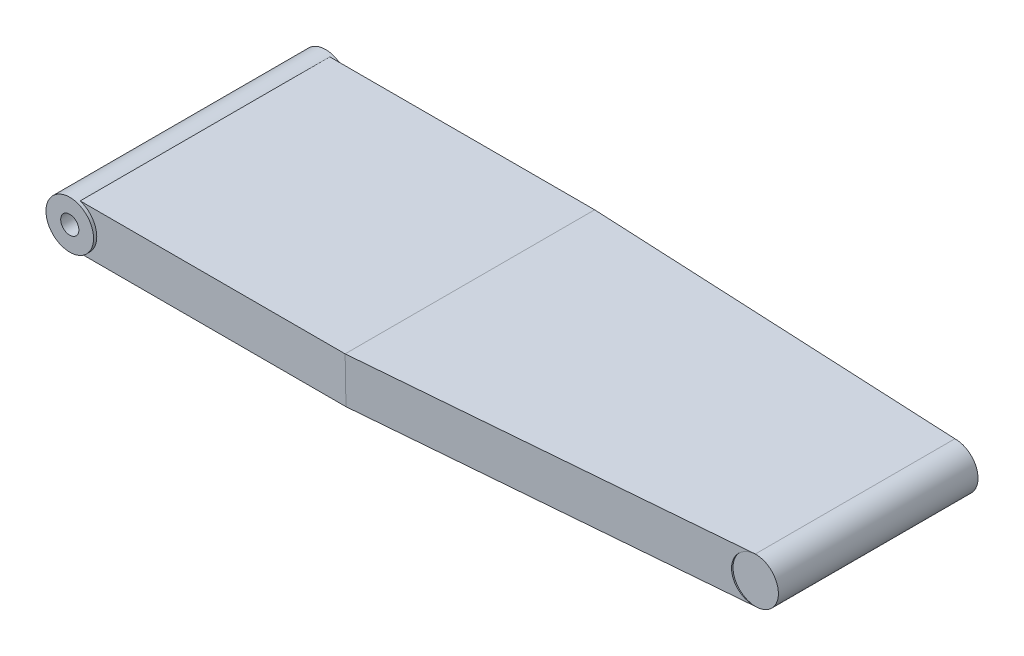
from build123d import *

# Parameters (mm, degrees)
RESSALTO_EXTRUS_O1_DEPTH = 28.2
RESSALTO_EXTRUS_O3_DEPTH = 22
RESSALTO_EXTRUS_O4_DEPTH = 27.5
RESSALTO_EXTRUS_O5_DEPTH = 27.5
CORTE_EXTRUS_O3_DEPTH    = 153.972464187
ESBO_O3_R                = 2
CORTE_EXTRUS_O4_DEPTH    = 161.384600668


with BuildPart() as part:
    # Esboço1 → Ressalto-extrusão1 (new, symmetric)
    with BuildSketch(Plane.XY):
        with BuildLine():
            ThreePointArc((5.25, 0), (4.239918087, 3.096061146), (1.598344907, 5.000779295))
            ThreePointArc((1.598344907, 5.000779295), (-5.25, 0), (1.598344907, -5.000779295))
            ThreePointArc((1.598344907, -5.000779295), (4.239918087, -3.096061146), (5.25, 0))
        make_face()
    extrude(amount=RESSALTO_EXTRUS_O1_DEPTH, both=True)

    # Esboço1<7> → Ressalto-extrusão4 (add, symmetric)
    with BuildSketch(Plane.XY):
        with BuildLine():
            Line((60, 5.000779295), (1.598344907, 5.000779295))
            ThreePointArc((1.598344907, 5.000779295), (4.239918087, 3.096061146), (5.25, 0))
            ThreePointArc((5.25, 0), (4.239918087, -3.096061146), (1.598344907, -5.000779295))
            Line((1.598344907, -5.000779295), (60, -5.000779295))
            Line((60, -5.000779295), (60, 5.000779295))
        make_face()
    extrude(amount=RESSALTO_EXTRUS_O4_DEPTH, both=True)



with BuildPart() as body_2:
    # Esboço1<5> → Ressalto-extrusão3 (new, symmetric)
    with BuildSketch(Plane.XY):
        with BuildLine():
            ThreePointArc((150, 1.500779295), (148.504187717, 5.067383905), (144.911732622, 6.500000121))
            ThreePointArc((144.911732622, 6.500000121), (140.000779174, 1.412511917), (145.088267378, -3.498441531))
            ThreePointArc((145.088267378, -3.498441531), (148.56660461, -2.003408422), (150, 1.500779295))
        make_face()
    extrude(amount=RESSALTO_EXTRUS_O3_DEPTH, both=True)


with BuildPart() as part_1:
    add(part.part)

    add(body_2.part)  # Ressalto-extrusão5 merges body 2
    # Esboço1<8> → Ressalto-extrusão5 (add, symmetric)
    with BuildSketch(Plane.XY):
        with BuildLine():
            Line((144.911732622, 6.500000121), (60, 5.000779295))
            Line((60, 5.000779295), (60, -5.000779295))
            Line((60, -5.000779295), (145.088267378, -3.498441531))
            ThreePointArc((145.088267378, -3.498441531), (140.000779174, 1.412511917), (144.911732622, 6.500000121))
        make_face()
    extrude(amount=RESSALTO_EXTRUS_O5_DEPTH, both=True)

    # Esboço2 → Corte-extrusão3 (cut, through all)
    with BuildSketch(Plane(origin=(-0.069568666, 3.940177355, 0), x_dir=(0.9998441652583014, 0.01765347554818762, 0), z_dir=(-0.017653475548187615, 0.9998441652583013, 0))):
        Polygon((60.078931051, -27.5), (145.003897933, -22), (145.003897933, -27.5), align=None)
        Polygon((60.078931051, 27.5), (145.003897933, 22), (145.003897933, 27.5), align=None)
    extrude(amount=-CORTE_EXTRUS_O3_DEPTH, mode=Mode.SUBTRACT)

    # Esboço3 → Corte-extrusão4 (cut, through all)
    with BuildSketch(Plane.XY.offset(28.2)):
        Circle(ESBO_O3_R)
    extrude(amount=-CORTE_EXTRUS_O4_DEPTH, mode=Mode.SUBTRACT)


solid = part_1.part
